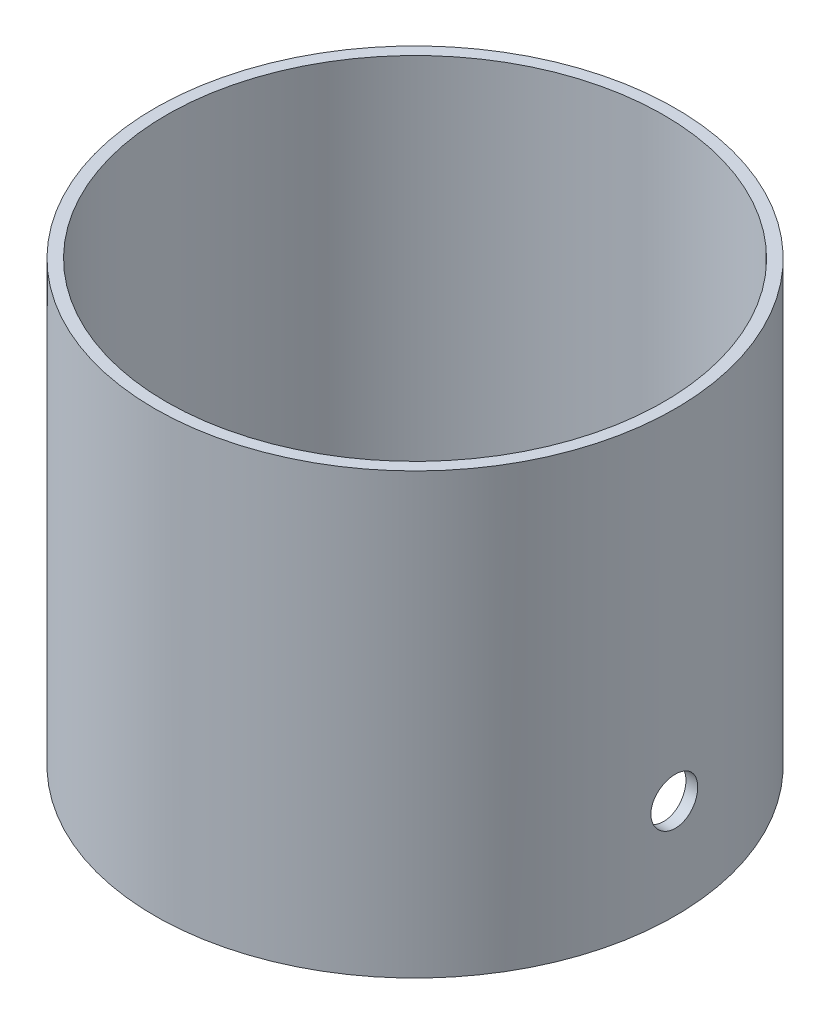
from build123d import *

# Parameters (mm, degrees)
SKETCH1_R               = 44.45
SKETCH1_R_2             = 42.45
BOSS_EXTRUDE1_DEPTH     = 37.5
CUT_EXTRUDE1_REACH      = 75.197
CUT_EXTRUDE1_END_RADIUS = 44.45
SKETCH2_W               = 8
SKETCH2_H               = 16
SKETCH3_R               = 4
CUT_EXTRUDE2_DEPTH      = 74.197370171


with BuildPart() as part:
    # Sketch1 → Boss-Extrude1 (new, symmetric)
    with BuildSketch(Plane(origin=(0, 0, 0), x_dir=(1, 0, 0), z_dir=(0, 1, 0))):
        with Locations(Location((0, 0, 0), (0, 0, 270))):
            Circle(SKETCH1_R)
        with Locations(Location((0, 0, 0), (0, 0, 270))):
            Circle(SKETCH1_R_2, mode=Mode.SUBTRACT)
    extrude(amount=BOSS_EXTRUDE1_DEPTH, both=True)

    # Cut-Extrude1: up to this cylinder (the profile starts inside it)
    cut_extrude1_end = Plane(origin=(0, -37.5, 0), z_dir=(0, -1, 0)) * Cylinder(CUT_EXTRUDE1_END_RADIUS, 240.294, mode=Mode.PRIVATE)
    # Sketch2 → Cut-Extrude1 (cut, up to the surface)
    with BuildSketch(Plane(origin=(0, 0, 0), x_dir=(0, 0, -1), z_dir=(1, 0, 0)), mode=Mode.PRIVATE) as cut_extrude1_sk1:
        with Locations((0, -37.5)):
            Rectangle(SKETCH2_W, SKETCH2_H)
    cut_extrude1_tool1 = extrude(cut_extrude1_sk1.sketch, amount=-CUT_EXTRUDE1_REACH, mode=Mode.PRIVATE) & cut_extrude1_end
    add(cut_extrude1_tool1.solids().sort_by_distance((0, -37.5, 0))[0], mode=Mode.SUBTRACT)

    # Sketch3 → Cut-Extrude2 (cut, through all)
    with BuildSketch(Plane(origin=(0, 0, 0), x_dir=(0, 0, -1), z_dir=(1, 0, 0))):
        with Locations(Location((0, -20.55, 0), (0, 0, 180))):
            Circle(SKETCH3_R)
    extrude(amount=CUT_EXTRUDE2_DEPTH, mode=Mode.SUBTRACT)


solid = part.part
